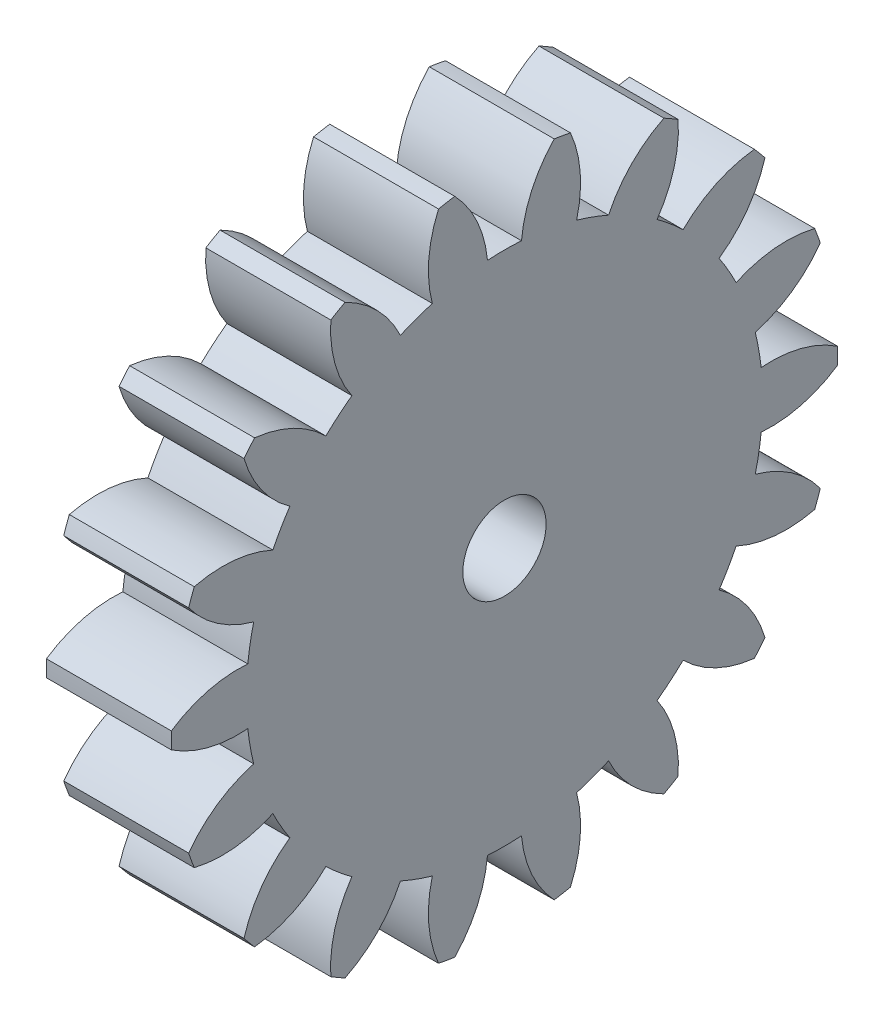
from build123d import *

# Parameters (mm, degrees)
BASPROSKE_W           = 12
BASPROSKE_H           = 8
TOOTHCUT_DEPTH        = 17.492422502
TEETHCUTS_COUNT       = 18
TEETHCUTS_ANGLE       = 340
BORSKE_R              = 1
BORE_DEPTH            = 50.0000508
CROQUIS1_W            = 17.780608964
CROQUIS1_H            = 17.85802816
CORTAR_EXTRUIR1_DEPTH = 9


with BuildPart() as part:
    # BasProSke → Base-Revolve (revolve)
    with BuildSketch(Plane(origin=(0, 0, 0), x_dir=(1, 0, 0), z_dir=(0, 1, 0)), mode=Mode.PRIVATE) as base_revolve_sk:
        with Locations((6, 4)):
            Rectangle(BASPROSKE_W, BASPROSKE_H)
    revolve(base_revolve_sk.sketch.rotate(Axis((-10, 0, 0), (1, 0, 0)), 180), axis=Axis((-10, 0, 0), (1, 0, 0)))

    # TooCutSke → ToothCut (cut, through all)
    with BuildSketch(Plane(origin=(0, 0, 0), x_dir=(0, 0, -1), z_dir=(1, 0, 0))):
        with BuildLine():
            ThreePointArc((0.407891456, 6.185565905), (0, 6.199), (-0.407891456, 6.185565905))
            ThreePointArc((-0.407891456, 6.185565905), (-0.661526256, 7.128665447), (-1.215753865, 7.932779317))
            ThreePointArc((-1.215753865, 7.932779317), (0, 8.0254), (1.215753865, 7.932779317))
            ThreePointArc((1.215753865, 7.932779317), (0.661526256, 7.128665447), (0.407891456, 6.185565905))
        make_face()
    toothcut = extrude(amount=TOOTHCUT_DEPTH, mode=Mode.SUBTRACT)

    # TeethCuts: ToothCut ×18 about axis
    teethcuts_axis = Axis((-10, 0, 0), (1, 0, 0))
    for i in range(1, TEETHCUTS_COUNT):
        add(toothcut.rotate(teethcuts_axis, i * TEETHCUTS_ANGLE / (TEETHCUTS_COUNT - 1)), mode=Mode.SUBTRACT)

    # BorSke → Bore (cut, symmetric)
    with BuildSketch(Plane(origin=(0, 0, 0), x_dir=(0, 0, -1), z_dir=(1, 0, 0))):
        with Locations(Location((0, 0, 0), (0, 0, 180))):
            Circle(BORSKE_R)
    extrude(amount=BORE_DEPTH, both=True, mode=Mode.SUBTRACT)

    # Croquis1 → Cortar-Extruir1 (cut)
    with BuildSketch(Plane.ZY):
        with Locations((0, 0.025806399)):
            Rectangle(CROQUIS1_W, CROQUIS1_H)
    extrude(amount=-CORTAR_EXTRUIR1_DEPTH, mode=Mode.SUBTRACT)


solid = part.part
